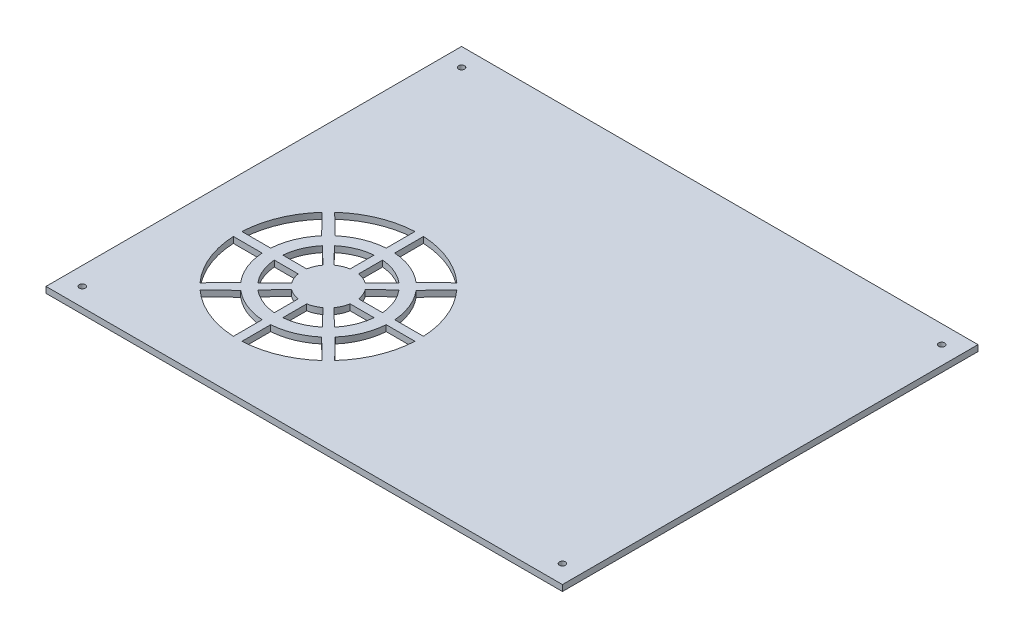
from build123d import *

# Parameters (mm, degrees)
SKETCH1_W           = 256
SKETCH1_H           = 206
BOSS_EXTRUDE1_DEPTH = 3
SKETCH2_R           = 1.5
CUT_EXTRUDE3_DEPTH  = 4
CUT_EXTRUDE6_DEPTH  = 4


with BuildPart() as part:
    # Sketch1 → Boss-Extrude1 (new body)
    with BuildSketch(Plane(origin=(0, 0, 0), x_dir=(1, 0, 0), z_dir=(0, 1, 0))):
        Rectangle(SKETCH1_W, SKETCH1_H)
    extrude(amount=BOSS_EXTRUDE1_DEPTH)

    # Sketch2 → Cut-Extrude3 (cut)
    with BuildSketch(Plane(origin=(0, 3, 0), x_dir=(1, 0, 0), z_dir=(0, 1, 0))):
        with Locations(Location((-119, 94, 0), (0, 0, 270))):
            Circle(SKETCH2_R)
        with Locations(Location((119, 94, 0), (0, 0, 270))):
            Circle(SKETCH2_R)
        with Locations(Location((119, -94, 0), (0, 0, 270))):
            Circle(SKETCH2_R)
        with Locations(Location((-119, -94, 0), (0, 0, 270))):
            Circle(SKETCH2_R)
    extrude(amount=-CUT_EXTRUDE3_DEPTH, mode=Mode.SUBTRACT)

    # Sketch5 → Cut-Extrude6 (cut)
    with BuildSketch(Plane(origin=(0, 3, 0), x_dir=(1, 0, 0), z_dir=(0, 1, 0))):
        with BuildLine():
            Line((-45.132956232, -35.122138654), (-33.270497542, -35.122138654))
            ThreePointArc((-33.270497542, -35.122138654), (-35.068849242, -42.49810977), (-39.012684657, -48.985418992))
            Line((-39.012684657, -48.985418992), (-47.527093129, -40.770618345))
            ThreePointArc((-47.527093129, -40.770618345), (-45.993141349, -38.089168216), (-45.132956232, -35.122138654))
        make_face()
        with BuildLine():
            Line((-34.575640496, -53.039857249), (-24.640816296, -63.279340889))
            ThreePointArc((-24.640816296, -63.279340889), (-16.366822155, -50.214880906), (-12.998109488, -35.122138654))
            Line((-12.998109488, -35.122138654), (-27.246251867, -35.122138654))
            ThreePointArc((-27.246251867, -35.122138654), (-29.467947906, -44.671268141), (-34.575640496, -53.039857249))
        make_face()
        with BuildLine():
            Line((-37.960142751, -56.424359504), (-27.720659111, -66.359183704))
            ThreePointArc((-27.720659111, -66.359183704), (-40.785119094, -74.633177845), (-55.877861346, -78.001890512))
            Line((-55.877861346, -78.001890512), (-55.877861346, -63.753748133))
            ThreePointArc((-55.877861346, -63.753748133), (-46.328731859, -61.532052094), (-37.960142751, -56.424359504))
        make_face()
        with BuildLine():
            Line((-55.877861346, -45.867043768), (-55.877861346, -57.729502458))
            ThreePointArc((-55.877861346, -57.729502458), (-48.50189023, -55.931150758), (-42.014581008, -51.987315343))
            Line((-42.014581008, -51.987315343), (-50.229381655, -43.472906871))
            ThreePointArc((-50.229381655, -43.472906871), (-52.910831784, -45.006858651), (-55.877861346, -45.867043768))
        make_face()
        with BuildLine():
            Line((-55.877861346, -2.246251867), (-55.877861346, 12.001890512))
            ThreePointArc((-55.877861346, 12.001890512), (-40.785119094, 8.633177845), (-27.720659111, 0.359183704))
            Line((-27.720659111, 0.359183704), (-37.960142751, -9.575640496))
            ThreePointArc((-37.960142751, -9.575640496), (-46.328731859, -4.467947906), (-55.877861346, -2.246251867))
        make_face()
        with BuildLine():
            Line((-55.877861346, -20.132956232), (-55.877861346, -8.270497542))
            ThreePointArc((-55.877861346, -8.270497542), (-48.50189023, -10.068849242), (-42.014581008, -14.012684657))
            Line((-42.014581008, -14.012684657), (-50.229381655, -22.527093129))
            ThreePointArc((-50.229381655, -22.527093129), (-52.910831784, -20.993141349), (-55.877861346, -20.132956232))
        make_face()
        with BuildLine():
            Line((-34.575640496, -12.960142751), (-24.640816296, -2.720659111))
            ThreePointArc((-24.640816296, -2.720659111), (-16.366822155, -15.785119094), (-12.998109488, -30.877861346))
            Line((-12.998109488, -30.877861346), (-27.246251867, -30.877861346))
            ThreePointArc((-27.246251867, -30.877861346), (-29.467947906, -21.328731859), (-34.575640496, -12.960142751))
        make_face()
        with BuildLine():
            Line((-45.132956232, -30.877861346), (-33.270497542, -30.877861346))
            ThreePointArc((-33.270497542, -30.877861346), (-35.068849242, -23.50189023), (-39.012684657, -17.014581008))
            Line((-39.012684657, -17.014581008), (-47.527093129, -25.229381655))
            ThreePointArc((-47.527093129, -25.229381655), (-45.993141349, -27.910831784), (-45.132956232, -30.877861346))
        make_face()
        with BuildLine():
            Line((-60.122138654, -45.867043768), (-60.122138654, -57.729502458))
            ThreePointArc((-60.122138654, -57.729502458), (-67.49810977, -55.931150758), (-73.985418992, -51.987315343))
            Line((-73.985418992, -51.987315343), (-65.770618345, -43.472906871))
            ThreePointArc((-65.770618345, -43.472906871), (-63.089168216, -45.006858651), (-60.122138654, -45.867043768))
        make_face()
        with BuildLine():
            Line((-60.122138654, -63.753748133), (-60.122138654, -78.001890512))
            ThreePointArc((-60.122138654, -78.001890512), (-75.214880906, -74.633177845), (-88.279340889, -66.359183704))
            Line((-88.279340889, -66.359183704), (-78.039857249, -56.424359504))
            ThreePointArc((-78.039857249, -56.424359504), (-69.671268141, -61.532052094), (-60.122138654, -63.753748133))
        make_face()
        with BuildLine():
            Line((-81.424359504, -53.039857249), (-91.359183704, -63.279340889))
            ThreePointArc((-91.359183704, -63.279340889), (-99.633177845, -50.214880906), (-103.001890512, -35.122138654))
            Line((-103.001890512, -35.122138654), (-88.753748133, -35.122138654))
            ThreePointArc((-88.753748133, -35.122138654), (-86.532052094, -44.671268141), (-81.424359504, -53.039857249))
        make_face()
        with BuildLine():
            Line((-70.867043768, -35.122138654), (-82.729502458, -35.122138654))
            ThreePointArc((-82.729502458, -35.122138654), (-80.931150758, -42.49810977), (-76.987315343, -48.985418992))
            Line((-76.987315343, -48.985418992), (-68.472906871, -40.770618345))
            ThreePointArc((-68.472906871, -40.770618345), (-70.006858651, -38.089168216), (-70.867043768, -35.122138654))
        make_face()
        with BuildLine():
            Line((-88.753748133, -30.877861346), (-103.001890512, -30.877861346))
            ThreePointArc((-103.001890512, -30.877861346), (-99.633177845, -15.785119094), (-91.359183704, -2.720659111))
            Line((-91.359183704, -2.720659111), (-81.424359504, -12.960142751))
            ThreePointArc((-81.424359504, -12.960142751), (-86.532052094, -21.328731859), (-88.753748133, -30.877861346))
        make_face()
        with BuildLine():
            Line((-70.867043768, -30.877861346), (-82.729502458, -30.877861346))
            ThreePointArc((-82.729502458, -30.877861346), (-80.931150758, -23.50189023), (-76.987315343, -17.014581008))
            Line((-76.987315343, -17.014581008), (-68.472906871, -25.229381655))
            ThreePointArc((-68.472906871, -25.229381655), (-70.006858651, -27.910831784), (-70.867043768, -30.877861346))
        make_face()
        with BuildLine():
            Line((-65.770618345, -22.527093129), (-73.985418992, -14.012684657))
            ThreePointArc((-73.985418992, -14.012684657), (-67.49810977, -10.068849242), (-60.122138654, -8.270497542))
            Line((-60.122138654, -8.270497542), (-60.122138654, -20.132956232))
            ThreePointArc((-60.122138654, -20.132956232), (-63.089168216, -20.993141349), (-65.770618345, -22.527093129))
        make_face()
        with BuildLine():
            Line((-78.039857249, -9.575640496), (-88.279340889, 0.359183704))
            ThreePointArc((-88.279340889, 0.359183704), (-75.214880906, 8.633177845), (-60.122138654, 12.001890512))
            Line((-60.122138654, 12.001890512), (-60.122138654, -2.246251867))
            ThreePointArc((-60.122138654, -2.246251867), (-69.671268141, -4.467947906), (-78.039857249, -9.575640496))
        make_face()
    extrude(amount=-CUT_EXTRUDE6_DEPTH, mode=Mode.SUBTRACT)


solid = part.part
